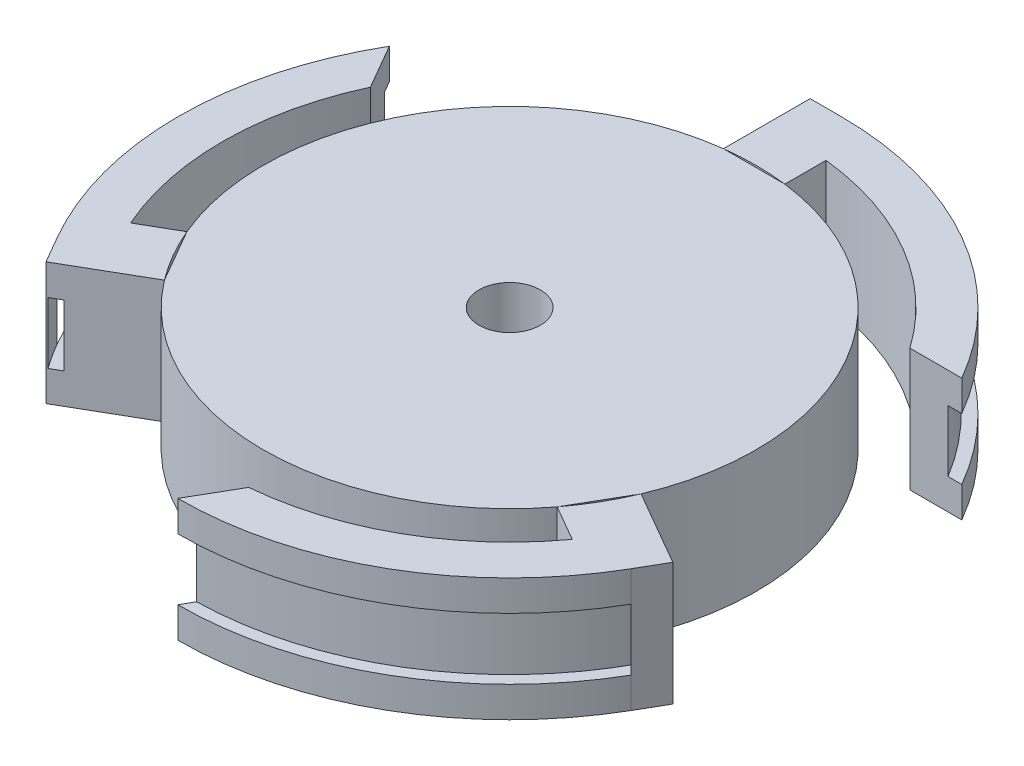
from build123d import *

# Parameters (mm, degrees)
BOSS_EXTRUDE1_DEPTH = 5
SKETCH2_R           = 26.9669807454053
SKETCH2_R_2         = 26
CUT_EXTRUDE1_DEPTH  = 2.5
SKETCH3_R           = 2.5
CUT_EXTRUDE2_DEPTH  = 7.5
SKETCH4_R           = 7.5
CUT_EXTRUDE3_DEPTH  = 3.5


with BuildPart() as part:
    # Sketch1 → Boss-Extrude1 (new, symmetric)
    with BuildSketch(Plane(origin=(0, 0, 0), x_dir=(1, 0, 0), z_dir=(0, 1, 0))):
        with BuildLine():
            ThreePointArc((20.063017132795874, 0), (15.044636906599731, 13.27341541651726), (2.49999999999975, 19.9066485494385))
            Line((2.5000000000000173, 19.906648549440643), (-2.4999999999982294, 19.906648549440643))
            ThreePointArc((-2.4999999999979883, 19.906648549438724), (-17.375082513563218, 10.031508566398701), (-18.48966334802226, -7.788260765258384))
            Line((-18.489663348024244, -7.788260765259216), (-15.98966334802512, -12.118387784179893))
            ThreePointArc((-15.989663348023583, -12.11838778417872), (-8.9466e-13, -20.063017132795874), (15.989663348022514, -12.118387784180133))
            Line((15.989663348024235, -12.11838778418143), (18.489663348023356, -7.788260765260754))
            ThreePointArc((18.489663348021576, -7.7882607652599996), (19.665745460086754, -3.9727964923889556), (20.063017132795874, -4.91e-15))
        make_face()
        with BuildLine():
            ThreePointArc((-15.989663348023583, -12.11838778417872), (-17.375082513564102, -10.031508566397168), (-18.489663348022262, -7.788260765258375))
            Line((-18.489663348024244, -7.788260765259216), (-21.3969713936379, -9.466795848011426))
            Line((-21.3969713936379, -9.466795848011426), (-24.50351667796262, -11.260360604166063))
            ThreePointArc((-24.503516677963194, -11.26036060416524), (-23.954607386329478, -12.385266871967934), (-23.35409038888675, -13.483490372702635))
            Line((-23.354090388886846, -13.48349037270269), (-22.104090388887734, -15.648553882162249))
            Line((-22.104090388887734, -15.648553882162249), (-15.98966334802512, -12.118387784179893))
        make_face()
        with BuildLine():
            Line((-24.50351667796262, -11.260360604166063), (-21.3969713936379, -9.466795848011426))
            ThreePointArc((-21.396971393638005, -9.46679584801125), (-23.396597505564916, 0.2232344298700557), (-21.21244090731292, 9.873345897001858))
            Line((-21.212440907312917, 9.873345897001856), (-23.325389447998635, 13.533080123248036))
            ThreePointArc((-23.32538944799864, 13.53308012324804), (-26.936587405932773, 1.2799646266991034), (-24.503516677963198, -11.26036060416524))
        make_face()
        with BuildLine():
            Line((24.604090388885975, -11.318426863243111), (18.489663348023356, -7.788260765260754))
            ThreePointArc((18.489663348021576, -7.7882607652599996), (17.375082513563214, -10.031508566398703), (15.989663348022514, -12.118387784180133))
            Line((15.989663348024235, -12.11838778418143), (18.896971393637905, -13.796922866933649))
            Line((18.896971393637905, -13.796922866933649), (22.003516677962654, -15.590487623088306))
            ThreePointArc((22.003516677962352, -15.590487623088949), (22.703259436938875, -14.552665098259599), (23.35409038888676, -13.483490372702617))
            Line((23.35409038888686, -13.483490372702676), (24.604090388885975, -11.318426863243111))
        make_face()
        with BuildLine():
            Line((22.003516677962654, -15.590487623088306), (18.896971393637905, -13.796922866933649))
            ThreePointArc((18.89697139363786, -13.796922866933729), (11.504972065515755, -20.37366501687383), (2.05565208650211, -23.307185650510142))
            Line((2.055652086502111, -23.307185650510142), (-0.05729645418372886, -26.966919876756325))
            ThreePointArc((-0.05729645418372531, -26.96691987675633), (12.359811820299626, -23.967751298147242), (22.003516677962352, -15.59048762308895))
        make_face()
        with BuildLine():
            ThreePointArc((2.500000000000001, 23.263718714945085), (11.891625440049078, 20.15043058700393), (19.1567888208108, 13.433839753508472))
            Line((19.156788820810803, 13.433839753508472), (23.382685902182367, 13.433839753508277))
            ThreePointArc((23.38268590218237, 13.433839753508279), (14.57677558563277, 22.687786671448528), (2.499999999999801, 26.85084822725454))
            Line((2.5000000000000204, 26.85084822725456), (2.500000000000019, 23.263718714945085))
        make_face()
        with BuildLine():
            Line((2.5000000000000178, 19.906648549440643), (2.500000000000019, 23.263718714945085))
            Line((2.500000000000019, 23.263718714945085), (2.5000000000000204, 26.85084822725456))
            ThreePointArc((2.499999999999801, 26.85084822725454), (1.2513479493900797, 26.937931970227677), (0, 26.966980745405245))
            Line((0, 26.966980745405355), (-2.4999999999982263, 26.966980745405355))
            Line((-2.4999999999982263, 26.966980745405355), (-2.4999999999982294, 19.906648549440643))
            ThreePointArc((-2.4999999999979883, 19.906648549438724), (8.8775e-13, 20.063017132795874), (2.49999999999975, 19.9066485494385))
        make_face()
    extrude(amount=BOSS_EXTRUDE1_DEPTH, both=True)

    # Sketch2 → Cut-Extrude1 (cut, symmetric)
    with BuildSketch(Plane(origin=(0, 0, 0), x_dir=(1, 0, 0), z_dir=(0, 1, 0))):
        Circle(SKETCH2_R)
        Circle(SKETCH2_R_2, mode=Mode.SUBTRACT)
    extrude(amount=CUT_EXTRUDE1_DEPTH, both=True, mode=Mode.SUBTRACT)

    # Sketch3 → Cut-Extrude2 (cut, symmetric)
    with BuildSketch(Plane(origin=(0, 5, 0), x_dir=(1, 0, 0), z_dir=(0, 1, 0))):
        with Locations(Location((0, 0, 0), (0, 0, 270))):
            Circle(SKETCH3_R)
    extrude(amount=CUT_EXTRUDE2_DEPTH, both=True, mode=Mode.SUBTRACT)

    # Sketch4 → Cut-Extrude3 (cut, symmetric)
    with BuildSketch(Plane(origin=(0, -2.4999999999999987, 0), x_dir=(1, 0, 0), z_dir=(0, 1, 0))):
        with Locations(Location((0, 0, 0), (0, 0, 270))):
            Circle(SKETCH4_R)
    extrude(amount=CUT_EXTRUDE3_DEPTH, both=True, mode=Mode.SUBTRACT)


solid = part.part
